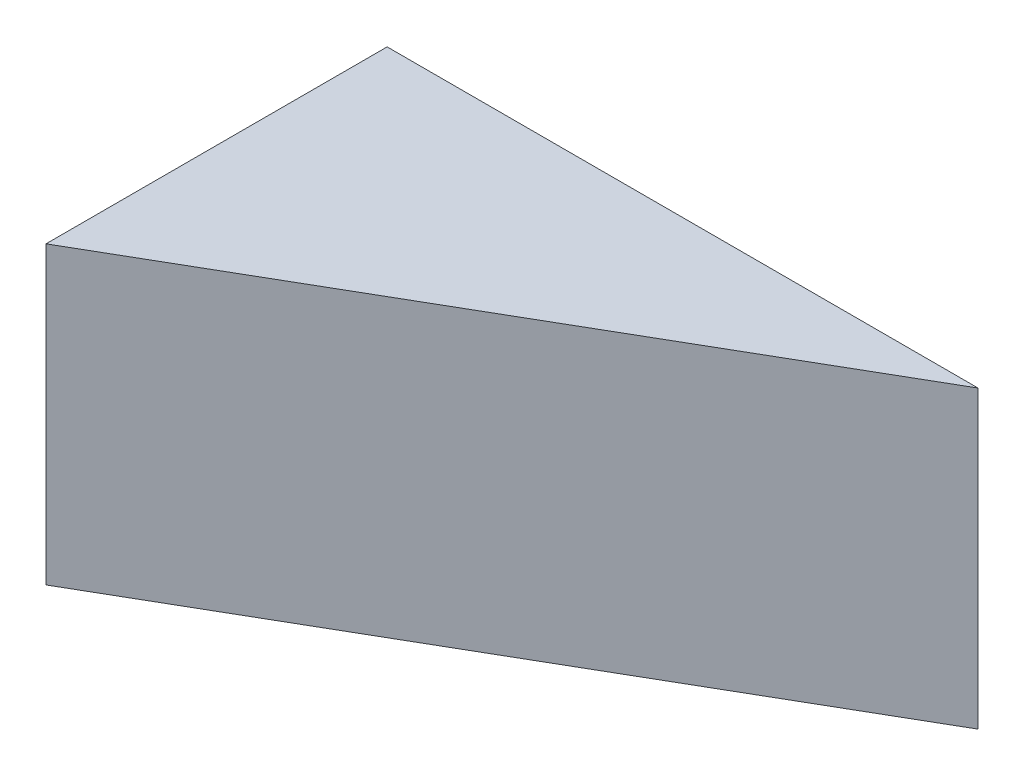
from build123d import *

# Parameters (mm, degrees)
BOSS_EXTRUDE1_DEPTH = 20


with BuildPart() as part:
    # Sketch1 → Boss-Extrude1 (new body)
    with BuildSketch(Plane(origin=(0, 0, 0), x_dir=(1, 0, 0), z_dir=(0, 1, 0))):
        Polygon((0, 0), (40, 0), (0, -23.094010768), align=None)
    extrude(amount=BOSS_EXTRUDE1_DEPTH)


solid = part.part
